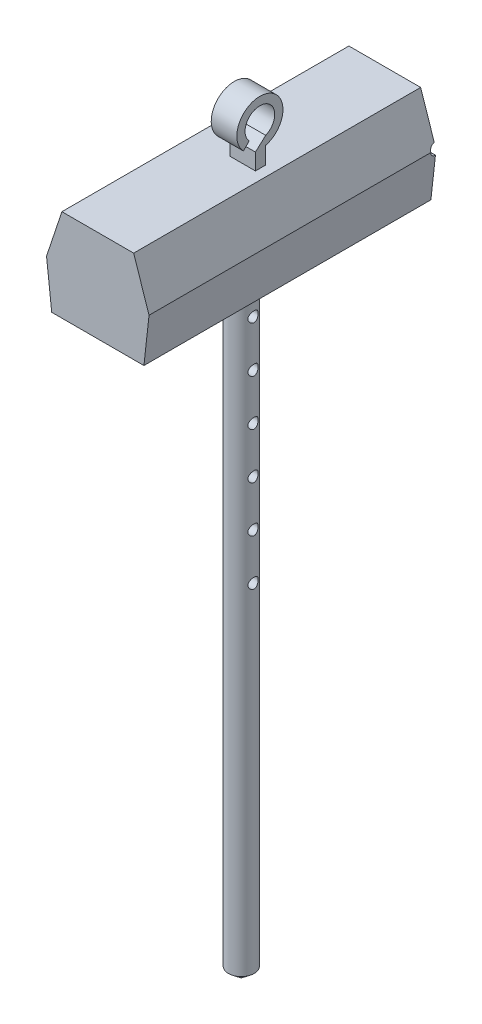
from build123d import *

# Parameters (mm, degrees)
BOSS_EXTRUDE1_DEPTH     = 280
BOSS_EXTRUDE3_DEPTH     = 25
SKETCH4_R               = 12.5
BOSS_EXTRUDE4_DEPTH     = 600
CUT_EXTRUDE1_DEPTH      = 715.09033042
CUT_EXTRUDE1_DEPTH_BACK = 715.09033042
SKETCH6_R               = 5


with BuildPart() as part:
    # Sketch1 → Boss-Extrude1 (new body)
    with BuildSketch(Plane.XY):
        Polygon((-35, 45), (35, 45), (50, 0), (45, -45), (-45, -45), (-50, 0), align=None)
    extrude(amount=BOSS_EXTRUDE1_DEPTH)

    # Sketch3 → Boss-Extrude3 (add)
    with BuildSketch(Plane(origin=(0, 0, 0), x_dir=(0, 0, -1), z_dir=(1, 0, 0))):
        with BuildLine():
            ThreePointArc((-157.297145542, 73.421881944), (-143.935749198, 97.677648593), (-141.188263605, 70.121878763))
            Line((-141.188263605, 70.121878763), (-141.188263605, 61.695526518))
            ThreePointArc((-141.188263605, 61.695526518), (-140.813452891, 105.148940986), (-162.939361475, 67.748621719))
            Line((-162.939361475, 67.748621719), (-157.297145542, 73.421881944))
        make_face()
        with BuildLine():
            Line((-141.188263605, 61.695526518), (-141.188263605, 70.121878763))
            Line((-141.188263605, 70.121878763), (-151.183383679, 60.972649139))
            Line((-151.183383679, 60.972649139), (-146.845730385, 60.972649139))
            ThreePointArc((-146.845730385, 60.972649139), (-143.993999241, 61.154100139), (-141.188263605, 61.695526518))
        make_face()
        with BuildLine():
            Line((-141.188263605, 45), (-141.188263605, 61.695526518))
            ThreePointArc((-141.188263605, 61.695526518), (-143.993999241, 61.154100139), (-146.845730385, 60.972649139))
            Line((-146.845730385, 60.972649139), (-151.183383679, 60.972649139))
            Line((-151.183383679, 60.972649139), (-151.183383679, 45))
            Line((-151.183383679, 45), (-146.845730385, 45))
            Line((-146.845730385, 45), (-141.188263605, 45))
        make_face()
    extrude(amount=BOSS_EXTRUDE3_DEPTH)

    # Sketch4 → Boss-Extrude4 (add)
    with BuildSketch(Plane.XZ.offset(45)):
        with Locations(Location((0, 140, 0), (0, 0, 180))):
            Circle(SKETCH4_R)
    extrude(amount=BOSS_EXTRUDE4_DEPTH)

    # Sketch5 → Revolve1 (revolve)
    with BuildSketch(Plane(origin=(0, 0, 0), x_dir=(0, 0, -1), z_dir=(1, 0, 0)), mode=Mode.PRIVATE) as revolve1_sk:
        Polygon((-127.5, -645), (-140, -645), (-140, -655), align=None)
    revolve(revolve1_sk.sketch.rotate(Axis((0, -618.479151268, 140), (0, 1, 0)), 180), axis=Axis((0, -618.479151268, 140), (0, 1, 0)))

    # Sketch6 → Cut-Extrude1 (cut, two sides: drawn at the far end of the back side and taken through both)
    with BuildSketch(Plane(origin=(0, 0, 0), x_dir=(0, 0, -1), z_dir=(1, 0, 0)).offset(-CUT_EXTRUDE1_DEPTH_BACK)):
        with Locations((-140, -90)):
            Circle(SKETCH6_R)
        with Locations((-140, -135)):
            Circle(SKETCH6_R)
        Circle(SKETCH6_R)
        with Locations((-140, -225)):
            Circle(SKETCH6_R)
        with Locations((-140, -270)):
            Circle(SKETCH6_R)
        with Locations((-140, -315)):
            Circle(SKETCH6_R)
        with Locations((-140, -180)):
            Circle(SKETCH6_R)
    extrude(amount=CUT_EXTRUDE1_DEPTH + CUT_EXTRUDE1_DEPTH_BACK, mode=Mode.SUBTRACT)


solid = part.part
